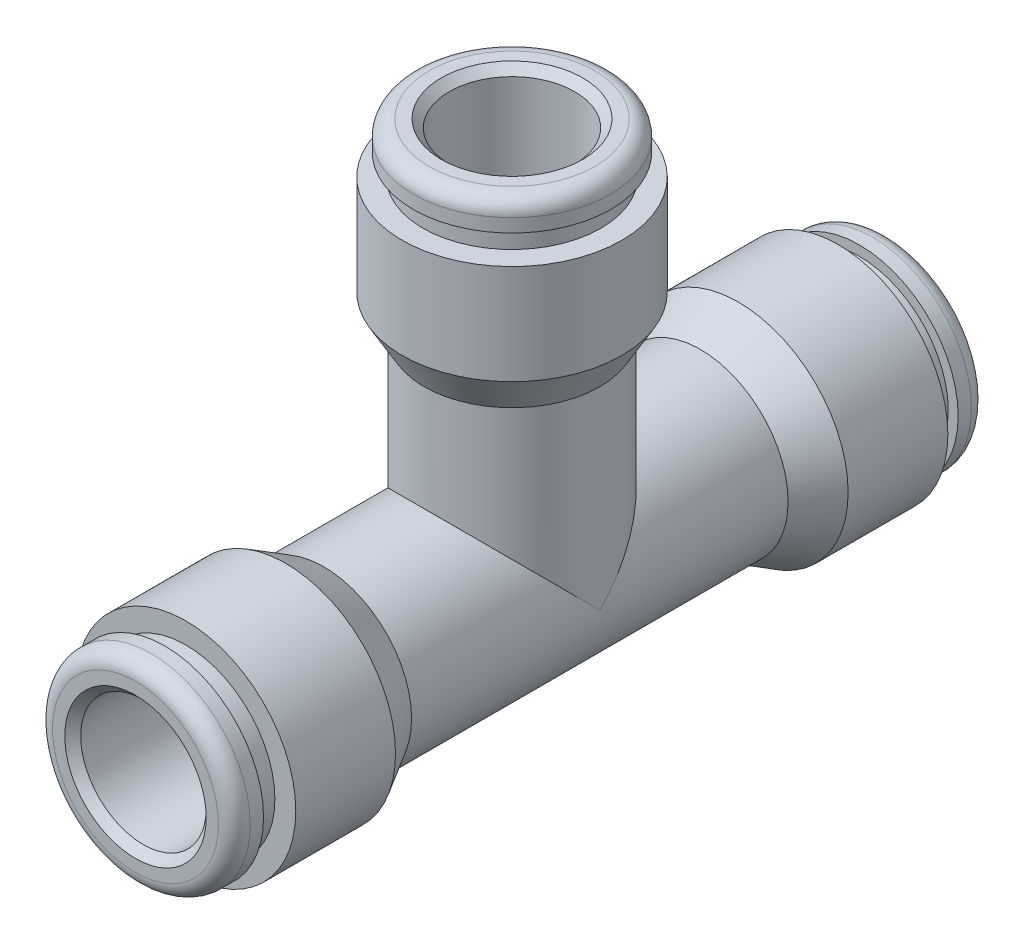
from build123d import *

# Parameters (mm, degrees)
CIRPATTERN1_COUNT   = 3
CIRPATTERN1_ANGLE   = 180
SKETCH3_R           = 4.2
BOSS_EXTRUDE1_DEPTH = 0.25
CIRPATTERN2_COUNT   = 2
CIRPATTERN2_ANGLE   = 180


with BuildPart() as part:
    # Sketch1 → Revolve1 (revolve)
    with BuildSketch(Plane(origin=(0, 0, 0), x_dir=(0, 0, -1), z_dir=(1, 0, 0)), mode=Mode.PRIVATE) as revolve1_sk:
        with BuildLine():
            Line((16.603, 4.725), (17.238, 4.725))
            ThreePointArc((17.238, 4.725), (17.776815367, 4.501815367), (18, 3.963))
            Line((18, 3.963), (18, 3.381))
            Line((18, 3.381), (17.619, 3))
            Line((17.619, 3), (5.75, 3))
            Line((5.75, 3), (5.75, 2.238))
            Line((5.75, 2.238), (0, 2.238))
            Line((0, 2.238), (0, 4.2))
            Line((0, 4.2), (9, 4.2))
            Line((9, 4.2), (10.818653348, 5.25))
            Line((10.818653348, 5.25), (15.587, 5.25))
            Line((15.587, 5.25), (15.587, 4.2525))
            Line((15.587, 4.2525), (16.603, 4.2525))
            Line((16.603, 4.2525), (16.603, 4.725))
        make_face()
    revolve(revolve1_sk.sketch.rotate(Axis((0, 0, 0), (0, 0, -1)), 90), axis=Axis((0, 0, 0), (0, 0, -1)))


with BuildPart() as cirpattern1_1:
    # CirPattern1: pattern copy
    add(part.part.rotate(Axis((0, 0, 0), (1, 0, 0)), 1 * CIRPATTERN1_ANGLE / (CIRPATTERN1_COUNT - 1)))


with BuildPart() as cirpattern1_2:
    # CirPattern1: pattern copy
    add(part.part.rotate(Axis((0, 0, 0), (1, 0, 0)), 2 * CIRPATTERN1_ANGLE / (CIRPATTERN1_COUNT - 1)))


with BuildPart() as cirpattern1_1_1:
    # Body-Move/Copy1: moved
    add(cirpattern1_1.part.moved(Location((0, 0.25, 0))))

    # Sketch3 → Boss-Extrude1 (add)
    with BuildSketch(Plane(origin=(0, 0, 0), x_dir=(1, 0, 0), z_dir=(0, 1, 0))):
        Circle(SKETCH3_R)
    extrude(amount=BOSS_EXTRUDE1_DEPTH)


with BuildPart() as cut_revolve2_tool:
    # Sketch4 → Cut-Revolve2 (revolve)
    with BuildSketch(Plane(origin=(0, 0, 0), x_dir=(0, 0, -1), z_dir=(1, 0, 0))):
        Polygon((3, 17.869), (3.381, 18.25), (0, 18.25), (0, 0), (2.238, 0), (2.238, 6), (3, 6), align=None)
    revolve(axis=Axis((0, 0, 0), (0, 1, 0)))


with BuildPart() as part_1:
    add(part.part)

    # Cut-Revolve2: cut by cut_revolve2_tool
    add(cut_revolve2_tool.part, mode=Mode.SUBTRACT)


with BuildPart() as cirpattern1_1_2:
    add(cirpattern1_1_1.part)

    # Cut-Revolve2: cut by cut_revolve2_tool
    add(cut_revolve2_tool.part, mode=Mode.SUBTRACT)


with BuildPart() as cirpattern1_2_1:
    add(cirpattern1_2.part)

    # Cut-Revolve2: cut by cut_revolve2_tool
    add(cut_revolve2_tool.part, mode=Mode.SUBTRACT)


with BuildPart() as part_2:
    add(part_1.part)

    # Combine1: union CirPattern1_1, CirPattern1_2
    add(cirpattern1_1_2.part)
    add(cirpattern1_2_1.part)

    # Sketch5 → Cut-Revolve1 (revolve, cut)
    with BuildSketch(Plane(origin=(0, 0, 0), x_dir=(0, 0, -1), z_dir=(1, 0, 0)), mode=Mode.PRIVATE) as cut_revolve1_sk:
        Polygon((18, 3.381), (17.619, 3), (5.75, 3), (5.75, 2.238), (0, 2.238), (0, 0), (18, 0), align=None)
    cut_revolve1 = revolve(cut_revolve1_sk.sketch.rotate(Axis((0, 0, 0), (0, 0, -1)), 90), axis=Axis((0, 0, 0), (0, 0, -1)), mode=Mode.SUBTRACT)

    # CirPattern2: Cut-Revolve1 ×2 about axis
    cirpattern2_axis = Axis((-5.775, 0, 0), (1, 0, 0))
    for i in range(1, CIRPATTERN2_COUNT):
        add(cut_revolve1.rotate(cirpattern2_axis, i * CIRPATTERN2_ANGLE / (CIRPATTERN2_COUNT - 1)), mode=Mode.SUBTRACT)


solid = part_2.part
